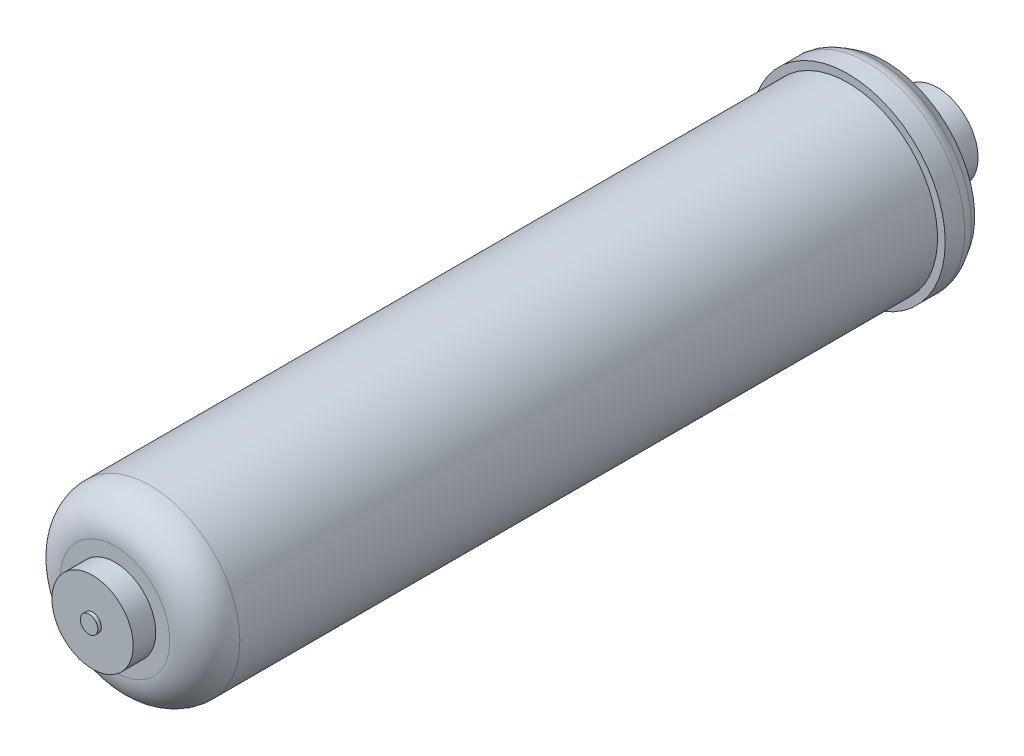
from build123d import *

# Parameters (mm, degrees)
FILLET1_R = 12.7
FILLET2_R = 6.35


with BuildPart() as part:
    # Sketch1 → Revolve1 (revolve)
    with BuildSketch(Plane(origin=(0, 0, 0), x_dir=(0, 0, -1), z_dir=(1, 0, 0)), mode=Mode.PRIVATE) as revolve1_sk:
        Polygon((0, 0), (0, 3.175), (-1.27, 3.175), (-1.27, 14.732), (-9.398, 14.732), (-20.32, 32.555084127), (-24.892, 35.306), (-33.7566, 35.306), (-33.7566, 32.512), (-299.4152, 32.512), (-299.4152, 14.732), (-307.594, 14.732), (-307.594, 3.175), (-308.864, 3.175), (-308.864, 0), align=None)
    revolve(revolve1_sk.sketch.rotate(Axis((0, 0, 0), (0, 0, 1)), 90), axis=Axis((0, 0, 0), (0, 0, 1)))

    # Fillet1
    fillet1_edges = [part.edges().sort_by_distance(p)[0] for p in [
        (32.512, 0, 299.4152),
    ]]
    fillet(fillet1_edges, radius=FILLET1_R)

    # Fillet2
    fillet2_edges = [part.edges().sort_by_distance(p)[0] for p in [
        (35.306, 0, 24.892),
    ]]
    fillet(fillet2_edges, radius=FILLET2_R)


solid = part.part
